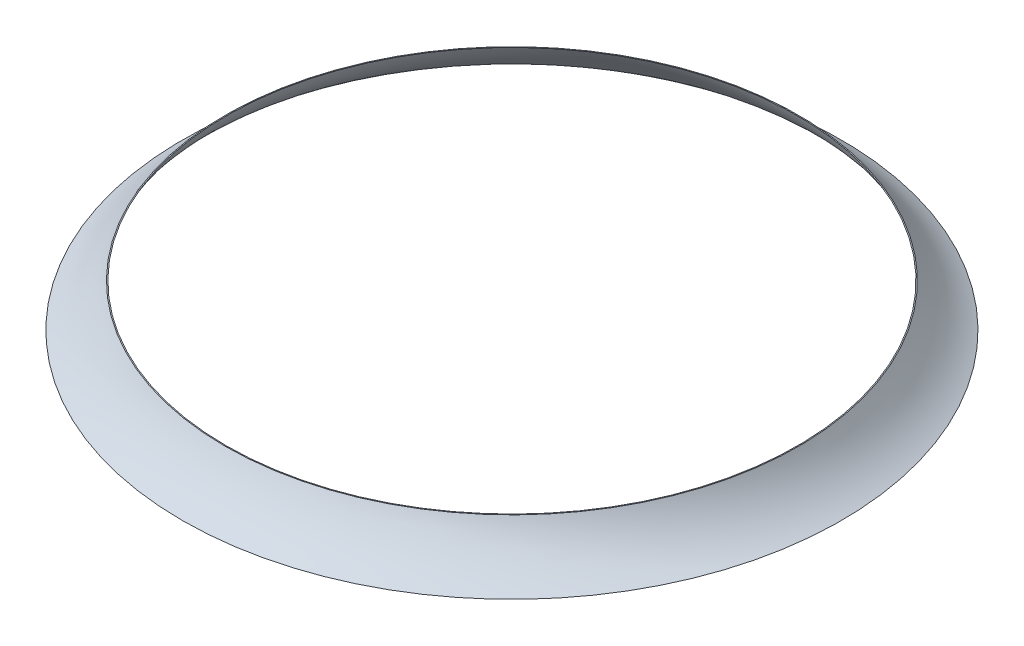
from build123d import *


with BuildPart() as part:
    # Sketch1 → Revolve1 (revolve)
    with BuildSketch(Plane(origin=(0, 0, 0), x_dir=(0, 0, -1), z_dir=(1, 0, 0)), mode=Mode.PRIVATE) as revolve1_sk:
        with BuildLine():
            Line((2016.363211372, 1309.476561725), (2013.56970797, 1309.476561725))
            ThreePointArc((2013.56970797, 1309.476561725), (2062.733023707, 1240.194876491), (2130.884590603, 1189.476561725))
            Line((2130.884590603, 1189.476561725), (2136.363211372, 1189.476561725))
            ThreePointArc((2136.363211372, 1189.476561725), (2066.662741903, 1239.776092257), (2016.363211372, 1309.476561725))
        make_face()
    revolve(revolve1_sk.sketch.rotate(Axis((0, 1309.476561725, -1213.363211372), (0, -1, 0)), 180), axis=Axis((0, 1309.476561725, -1213.363211372), (0, -1, 0)))


solid = part.part
